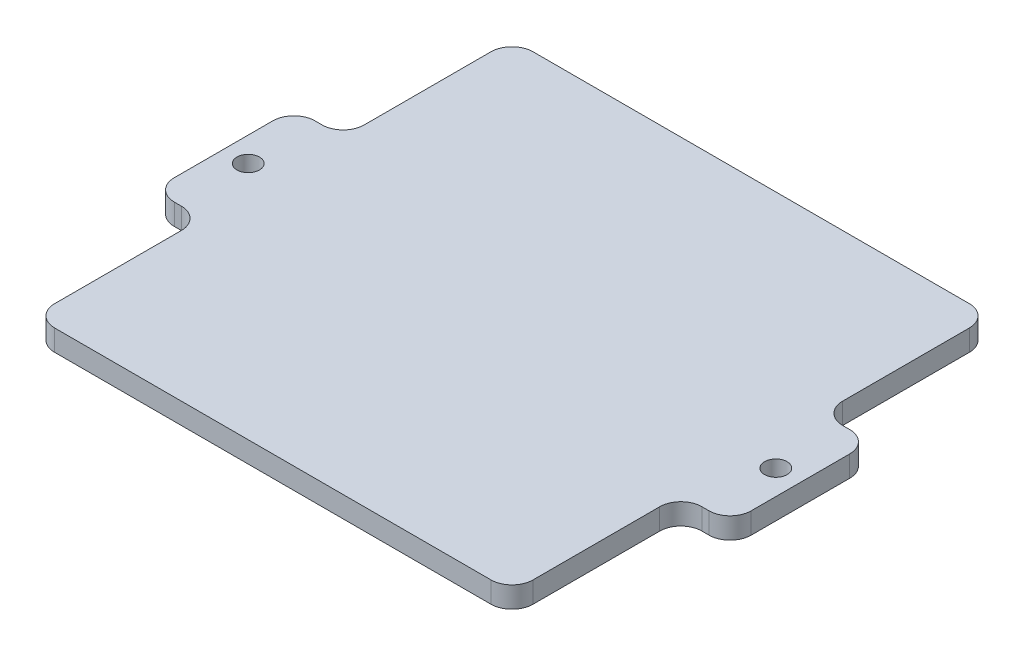
from build123d import *

# Parameters (mm, degrees)
SKETCH1_W           = 68
SKETCH1_H           = 68
BOSS_EXTRUDE1_DEPTH = 3
SKETCH2_W           = 7
SKETCH2_H           = 20
SKETCH2_R           = 1.6
BOSS_EXTRUDE2_DEPTH = 3
FILLET1_R           = 3


with BuildPart() as part:
    # Sketch1 → Boss-Extrude1 (new body)
    with BuildSketch(Plane(origin=(0, 0, 0), x_dir=(1, 0, 0), z_dir=(0, 1, 0))):
        Rectangle(SKETCH1_W, SKETCH1_H)
    extrude(amount=BOSS_EXTRUDE1_DEPTH)

    # Sketch2 → Boss-Extrude2 (add)
    # profile 1 of 2: a face of its own
    with BuildSketch(Plane(origin=(0, 3, 0), x_dir=(1, 0, 0), z_dir=(0, 1, 0))):
        with Locations((37.5, 0)):
            Rectangle(SKETCH2_W, SKETCH2_H)
        with Locations(Location((37.5, 0, 0), (0, 0, 270))):
            Circle(SKETCH2_R, mode=Mode.SUBTRACT)
    # profile 2 of 2: a face of its own
    with BuildSketch(Plane(origin=(0, 3, 0), x_dir=(1, 0, 0), z_dir=(0, 1, 0))):
        with Locations((-37.5, 0)):
            Rectangle(SKETCH2_W, SKETCH2_H)
        with Locations(Location((-37.5, 0, 0), (0, 0, 270))):
            Circle(SKETCH2_R, mode=Mode.SUBTRACT)
    extrude(amount=-BOSS_EXTRUDE2_DEPTH)

    # Fillet1
    fillet1_edges = [part.edges().sort_by_distance(p)[0] for p in [
        (34, 1.5, 10),
        (41, 1.5, 10),
        (41, 1.5, -10),
        (34, 1.5, -10),
        (-41, 1.5, -10),
        (-41, 1.5, 10),
        (-34, 1.5, 10),
        (-34, 1.5, -10),
        (-34, 1.5, 34),
        (34, 1.5, 34),
        (34, 1.5, -34),
        (-34, 1.5, -34),
    ]]
    fillet(fillet1_edges, radius=FILLET1_R)


solid = part.part
